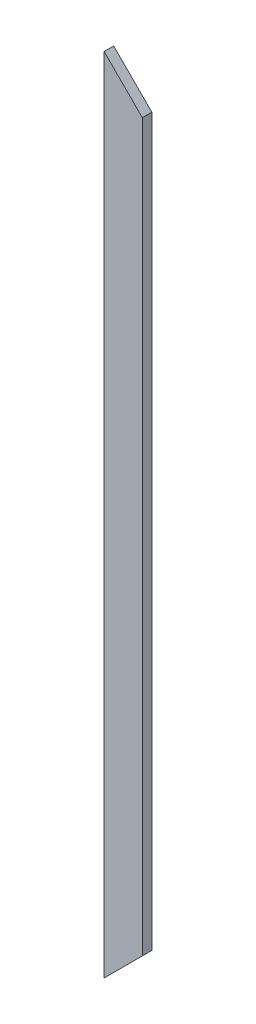
from build123d import *

# Parameters (mm, degrees)
BOSS_EXTRU_1_DEPTH = 5


with BuildPart() as part:
    # Esquisse1 → Boss.-Extru.1 (new body)
    with BuildSketch(Plane.XY):
        Polygon((0, 0), (10, 0), (20, 0), (20, -190), (10, -200), (0, -210), align=None)
    boss_extru_1 = extrude(amount=BOSS_EXTRU_1_DEPTH)

    # Symétrie1: Boss.-Extru.1 across plane
    add(boss_extru_1.mirror(Plane(origin=(0, 0, 5), x_dir=(0, 0, 1), z_dir=(0, -1, 0))))


solid = part.part
